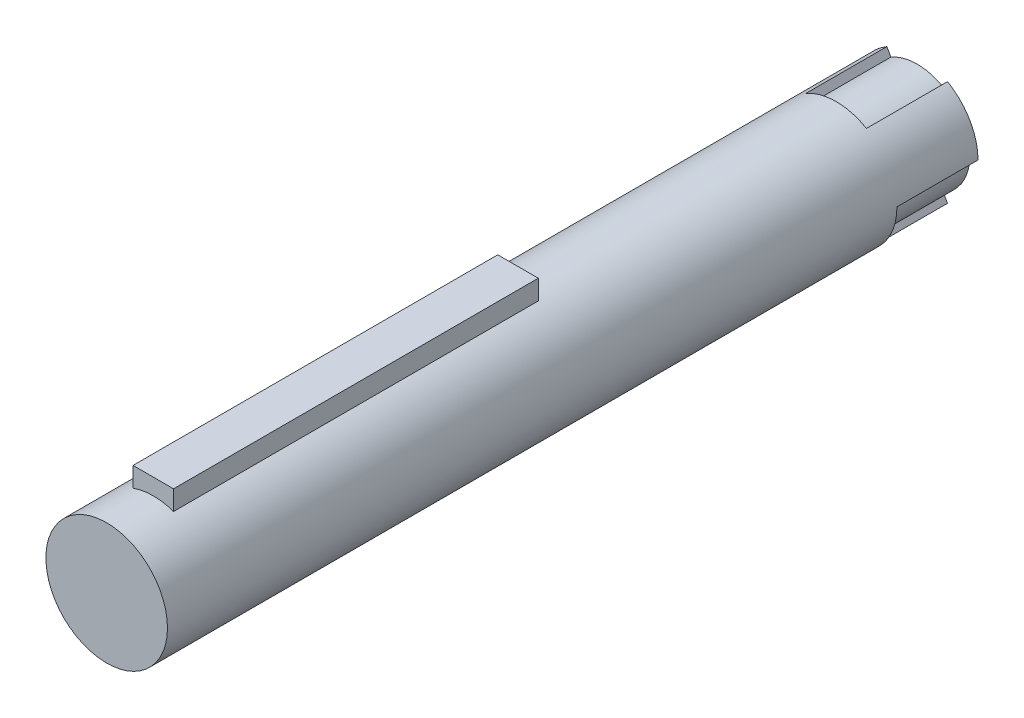
from build123d import *

# Parameters (mm, degrees)
ESBO_O1_R                = 7.5
RESSALTO_EXTRUS_O1_DEPTH = 100
ESBO_O2_W                = 5
ESBO_O2_H                = 45
RESSALTO_EXTRUS_O2_DEPTH = 9.5
CORTE_EXTRUS_O2_START    = -10
CORTE_EXTRUS_O2_DEPTH    = 10
CORTE_EXTRUS_O3_START    = -10
CORTE_EXTRUS_O3_DEPTH    = 10


with BuildPart() as part:
    # Esboço1 → Ressalto-extrusão1 (new body)
    with BuildSketch(Plane.XY):
        Circle(ESBO_O1_R)
    extrude(amount=-RESSALTO_EXTRUS_O1_DEPTH)

    # Esboço2 → Ressalto-extrusão2 (add)
    with BuildSketch(Plane(origin=(0, 0, 0), x_dir=(1, 0, 0), z_dir=(0, 1, 0))):
        with Locations((0, 28.25)):
            Rectangle(ESBO_O2_W, ESBO_O2_H)
    extrude(amount=RESSALTO_EXTRUS_O2_DEPTH)

    # Esboço3 → Corte-extrusão2 (cut)
    with BuildSketch(Plane(origin=(0, 0, -100), x_dir=(-1, 0, 0), z_dir=(0, 0, -1)).offset(CORTE_EXTRUS_O2_START)):
        with BuildLine():
            ThreePointArc((3.741657387, 6.5), (0, 7.5), (-3.741657387, 6.5))
            Line((-3.741657387, 6.5), (-3.242769735, 5.633333333))
            ThreePointArc((-3.242769735, 5.633333333), (0, 6.5), (3.242769735, 5.633333333))
            Line((3.242769735, 5.633333333), (3.741657387, 6.5))
        make_face()
    extrude(amount=CORTE_EXTRUS_O2_DEPTH, mode=Mode.SUBTRACT)

    # Esboço3<5> → Corte-extrusão3 (cut)
    with BuildSketch(Plane(origin=(0, 0, -100), x_dir=(-1, 0, 0), z_dir=(0, 0, -1)).offset(CORTE_EXTRUS_O3_START)):
        with BuildLine():
            Line((-6.5, 0), (-7.5, 0))
            ThreePointArc((-7.5, 0), (-6.492781777, -3.754168989), (-3.741657387, -6.5))
            Line((-3.741657387, -6.5), (-3.242769735, -5.633333333))
            ThreePointArc((-3.242769735, -5.633333333), (-5.62707754, -3.253613124), (-6.5, 0))
        make_face()
        with BuildLine():
            ThreePointArc((6.5, 0), (5.863181424, -2.805905129), (4.077506587, -5.062009485))
            Line((4.077506587, -5.062009485), (4.704815293, -5.840780175))
            ThreePointArc((4.704815293, -5.840780175), (6.765209335, -3.237582841), (7.5, 0))
            Line((7.5, 0), (6.5, 0))
        make_face()
    extrude(amount=CORTE_EXTRUS_O3_DEPTH, mode=Mode.SUBTRACT)


solid = part.part
